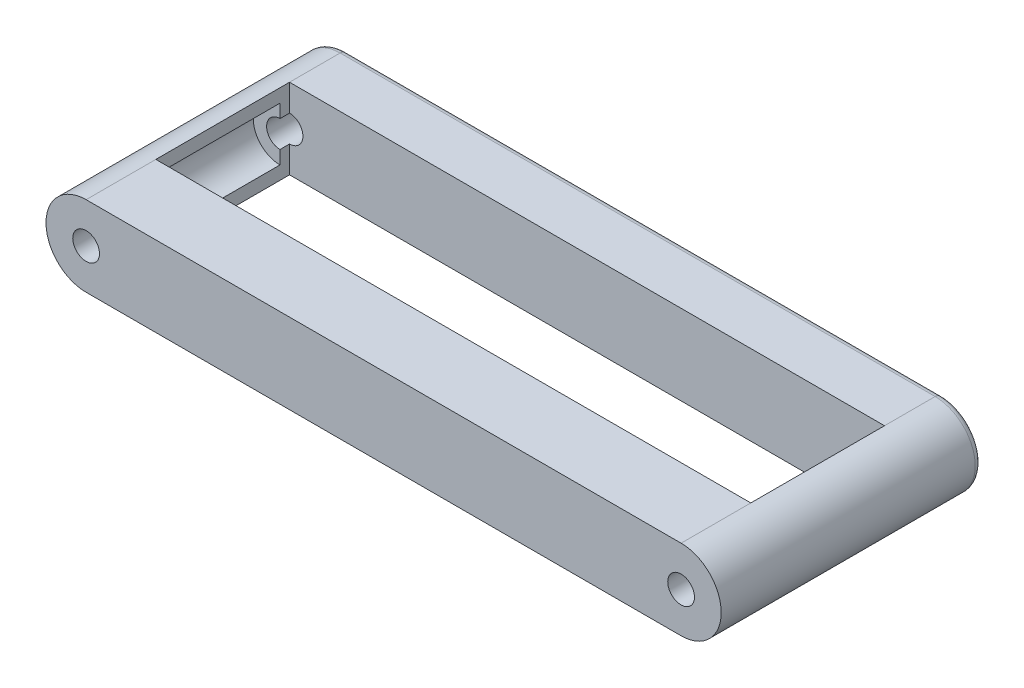
from build123d import *

# Parameters (mm, degrees)
CROQUIS1_R              = 2
SALIENTE_EXTRUIR1_DEPTH = 39
CROQUIS2_W              = 89
CROQUIS2_H              = 20
CORTAR_EXTRUIR1_DEPTH   = 39
CORTAR_EXTRUIR2_START   = -5
CROQUIS4_R              = 4
CORTAR_EXTRUIR2_DEPTH   = 24
REDONDEO1_R             = 1


with BuildPart() as part:
    # Croquis1 → Saliente-Extruir1 (new body)
    with BuildSketch(Plane.XY):
        with BuildLine():
            Line((-44.5, 6), (44.5, 6))
            ThreePointArc((44.5, 6), (50.5, 0), (44.5, -6))
            Line((44.5, -6), (-44.5, -6))
            ThreePointArc((-44.5, -6), (-50.5, 0), (-44.5, 6))
        make_face()
        with Locations((-44.5, 0)):
            Circle(CROQUIS1_R, mode=Mode.SUBTRACT)
        with Locations(Location((44.5, 0, 0), (0, 0, 180))):
            Circle(CROQUIS1_R, mode=Mode.SUBTRACT)
    extrude(amount=SALIENTE_EXTRUIR1_DEPTH)

    # Croquis2 → Cortar-Extruir1 (cut)
    with BuildSketch(Plane(origin=(0, 6, 0), x_dir=(1, 0, 0), z_dir=(0, 1, 0))):
        with Locations((0, -18.571649076)):
            Rectangle(CROQUIS2_W, CROQUIS2_H)
    extrude(amount=-CORTAR_EXTRUIR1_DEPTH, mode=Mode.SUBTRACT)

    # Croquis4 → Cortar-Extruir2 (cut)
    with BuildSketch(Plane.XY.offset(39).offset(CORTAR_EXTRUIR2_START)):
        with Locations((44.5, 0)):
            Circle(CROQUIS4_R)
        with Locations(Location((-44.5, 0, 0), (0, 0, 270))):
            Circle(CROQUIS4_R)
    extrude(amount=-CORTAR_EXTRUIR2_DEPTH, mode=Mode.SUBTRACT)

    # Redondeo1
    redondeo1_edges = [part.edges().sort_by_distance(p)[0] for p in [
        (-46.5, 0, 0),
        (46.5, 0, 0),
        (0, 6, 0),
        (50.5, 0, 0),
        (0, -6, 0),
        (-50.5, 0, 0),
    ]]
    fillet(redondeo1_edges, radius=REDONDEO1_R)


solid = part.part
